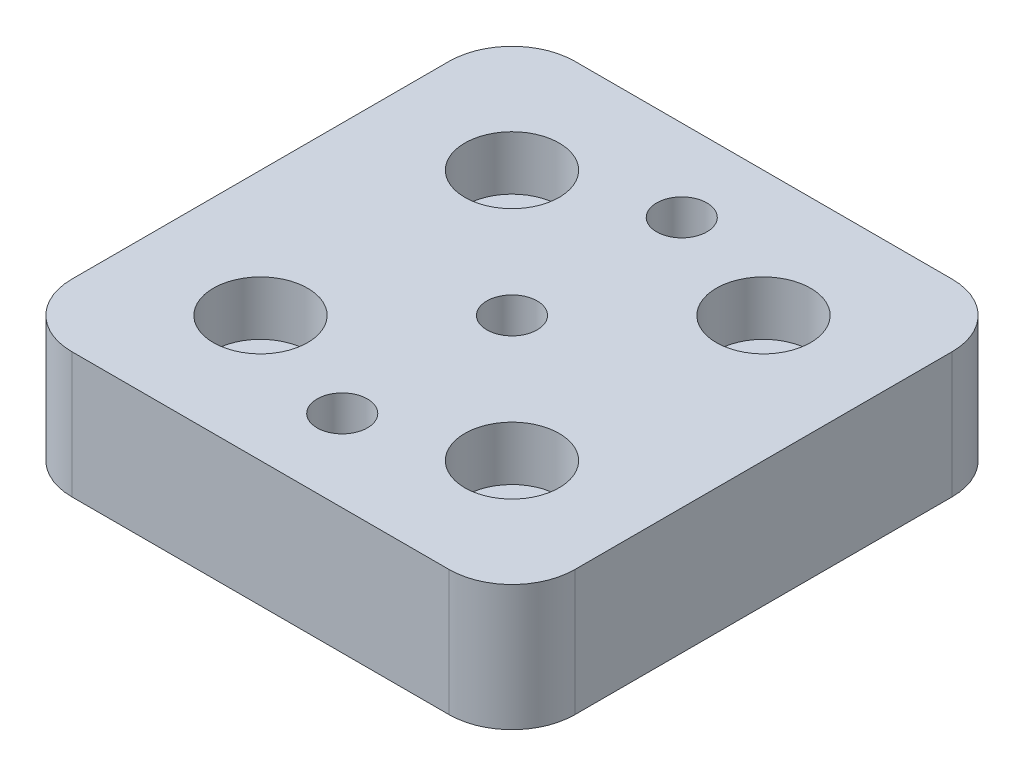
from build123d import *

# Parameters (mm, degrees)
SZKIC1_W                                            = 80
SZKIC1_H                                            = 80
DODANIE_WYCI_GNI_CIE1_DEPTH                         = 20
POG_BIENIE_WALCOWE_POD_M8_WKR_T_Z_BEM_W_D           = 9
POG_BIENIE_WALCOWE_POD_M8_WKR_T_Z_BEM_W_CBORE_D     = 15
POG_BIENIE_WALCOWE_POD_M8_WKR_T_Z_BEM_W_CBORE_DEPTH = 8.6
OTWORY_USTALAJ_CE_8_0MM1_D                          = 8
ZAOKR_GLENIE1_R                                     = 10


with BuildPart() as part:
    # Szkic1 → Dodanie-wyciągnięcie1 (new body)
    with BuildSketch(Plane(origin=(0, 0, 0), x_dir=(1, 0, 0), z_dir=(0, 1, 0))):
        Rectangle(SZKIC1_W, SZKIC1_H)
    extrude(amount=DODANIE_WYCI_GNI_CIE1_DEPTH)

    # Pogłębienie walcowe pod M8 Wkręt z łbem walcowym z gniazdem sześciokątnym1 (through all)
    with Locations(Plane(origin=(0, 20, 0), x_dir=(1, 0, 0), z_dir=(0, 1, 0))):
        with Locations((-20, 20), (20, 20), (20, -20), (-20, -20)):
            CounterBoreHole(POG_BIENIE_WALCOWE_POD_M8_WKR_T_Z_BEM_W_D / 2, POG_BIENIE_WALCOWE_POD_M8_WKR_T_Z_BEM_W_CBORE_D / 2, POG_BIENIE_WALCOWE_POD_M8_WKR_T_Z_BEM_W_CBORE_DEPTH)

    # Otwory ustalające Ø8.0mm1 (through all)
    with Locations(Plane(origin=(0, 20, 0), x_dir=(1, 0, 0), z_dir=(0, 1, 0))):
        with Locations((0, 27), (0, 0), (0, -27)):
            Hole(OTWORY_USTALAJ_CE_8_0MM1_D / 2)

    # Zaokrąglenie1
    zaokr_glenie1_edges = [part.edges().sort_by_distance(p)[0] for p in [
        (40, 10, 40),
        (-40, 10, 40),
        (-40, 10, -40),
        (40, 10, -40),
    ]]
    fillet(zaokr_glenie1_edges, radius=ZAOKR_GLENIE1_R)


solid = part.part
